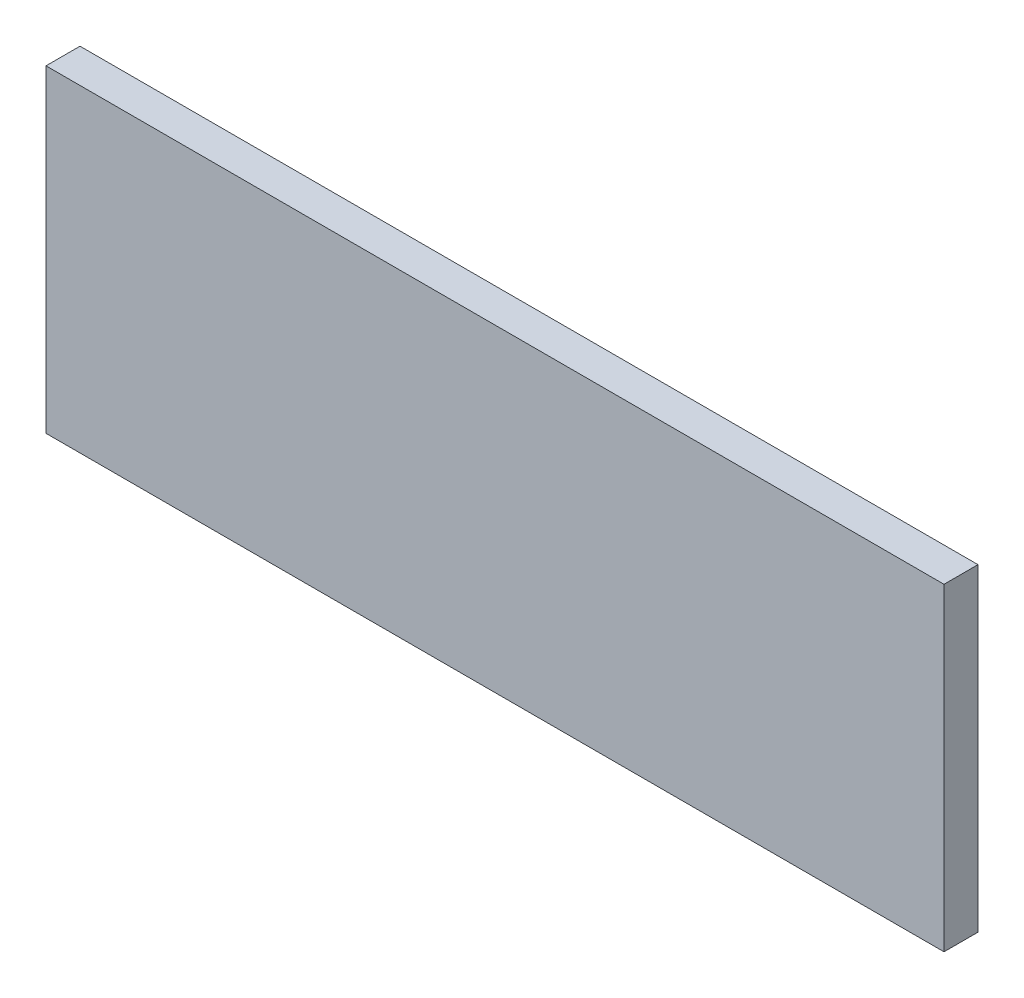
from build123d import *

# Parameters (mm, degrees)
SKETCH1_W           = 67.087444336
SKETCH1_H           = 23.780334328
BOSS_EXTRUDE1_DEPTH = 2.54


with BuildPart() as part:
    # Sketch1 → Boss-Extrude1 (new body)
    with BuildSketch(Plane.XY):
        Rectangle(SKETCH1_W, SKETCH1_H)
    extrude(amount=BOSS_EXTRUDE1_DEPTH)


solid = part.part
